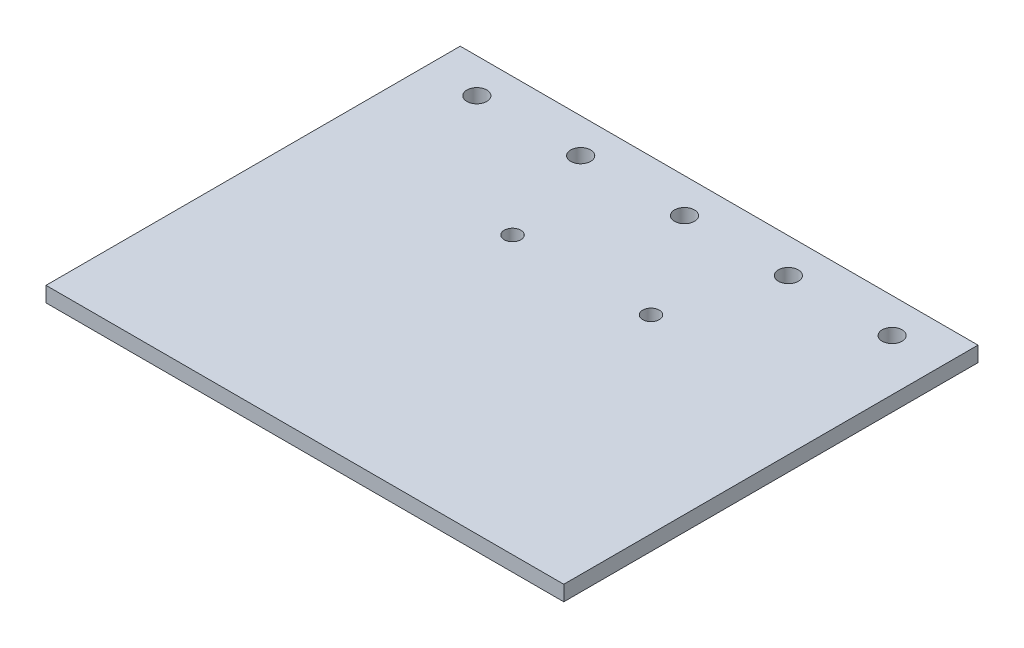
from build123d import *

# Parameters (mm, degrees)
SKETCH1_W           = 95
SKETCH1_H           = 76
BOSS_EXTRUDE1_DEPTH = 2.794
SKETCH2_R           = 1.8288
CUT_EXTRUDE1_DEPTH  = 61.893812789
SKETCH3_R           = 1.524
CUT_EXTRUDE2_DEPTH  = 61.893812789


with BuildPart() as part:
    # Sketch1 → Boss-Extrude1 (new body)
    with BuildSketch(Plane(origin=(0, 0, 0), x_dir=(1, 0, 0), z_dir=(0, 1, 0))):
        Rectangle(SKETCH1_W, SKETCH1_H)
    extrude(amount=BOSS_EXTRUDE1_DEPTH)

    # Sketch2 → Cut-Extrude1 (cut, through all)
    with BuildSketch(Plane(origin=(0, 2.794, 0), x_dir=(1, 0, 0), z_dir=(0, 1, 0))):
        with Locations(Location((-38.1, 31.65, 0), (0, 0, 270))):
            Circle(SKETCH2_R)
        with Locations(Location((-19.05, 31.65, 0), (0, 0, 270))):
            Circle(SKETCH2_R)
        with Locations(Location((0, 31.65, 0), (0, 0, 270))):
            Circle(SKETCH2_R)
        with Locations(Location((19.05, 31.65, 0), (0, 0, 270))):
            Circle(SKETCH2_R)
        with Locations(Location((38.1, 31.65, 0), (0, 0, 270))):
            Circle(SKETCH2_R)
    extrude(amount=-CUT_EXTRUDE1_DEPTH, mode=Mode.SUBTRACT)

    # Sketch3 → Cut-Extrude2 (cut, through all)
    with BuildSketch(Plane(origin=(0, 2.794, 0), x_dir=(1, 0, 0), z_dir=(0, 1, 0))):
        with Locations(Location((-12.7, 12.8, 0), (0, 0, 270))):
            Circle(SKETCH3_R)
        with Locations(Location((12.7, 12.8, 0), (0, 0, 270))):
            Circle(SKETCH3_R)
    extrude(amount=-CUT_EXTRUDE2_DEPTH, mode=Mode.SUBTRACT)


solid = part.part
